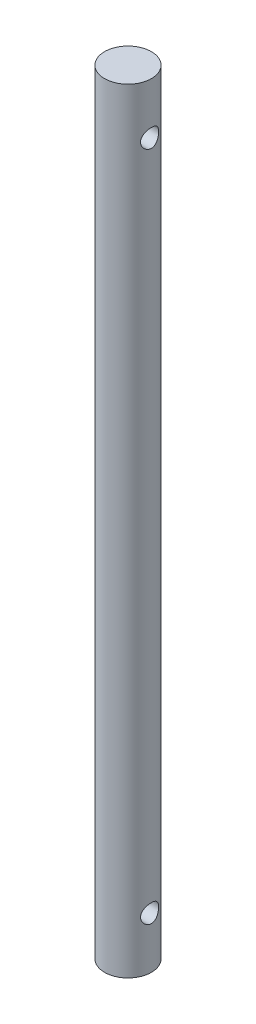
from build123d import *

# Parameters (mm, degrees)
SKETCH1_R           = 3.937
BOSS_EXTRUDE1_DEPTH = 65.0875
SKETCH2_W           = 14.723977987
SKETCH2_H           = 1.524
SKETCH3_W           = 14.493300334
SKETCH3_H           = 1.524


with BuildPart() as part:
    # Sketch1 → Boss-Extrude1 (new, symmetric)
    with BuildSketch(Plane(origin=(0, 0, 0), x_dir=(1, 0, 0), z_dir=(0, 1, 0))):
        with Locations(Location((0, 0, 0), (0, 0, 270))):
            Circle(SKETCH1_R)
    extrude(amount=BOSS_EXTRUDE1_DEPTH, both=True)

    # Sketch2 → Cut-Revolve1 (revolve, cut)
    with BuildSketch(Plane.XY, mode=Mode.PRIVATE) as cut_revolve1_sk:
        with Locations((0.698328764, 57.2135)):
            Rectangle(SKETCH2_W, SKETCH2_H)
    revolve(cut_revolve1_sk.sketch.rotate(Axis((-6.663660229, 56.4515, 0), (1, 0, 0)), 90), axis=Axis((-6.663660229, 56.4515, 0), (1, 0, 0)), mode=Mode.SUBTRACT)

    # Sketch3 → Cut-Revolve2 (revolve, cut)
    with BuildSketch(Plane.XY, mode=Mode.PRIVATE) as cut_revolve2_sk:
        with Locations((0.075239778, -57.2135)):
            Rectangle(SKETCH3_W, SKETCH3_H)
    revolve(cut_revolve2_sk.sketch.rotate(Axis((-7.171410389, -56.4515, 0), (1, 0, 0)), 270), axis=Axis((-7.171410389, -56.4515, 0), (1, 0, 0)), mode=Mode.SUBTRACT)


solid = part.part
